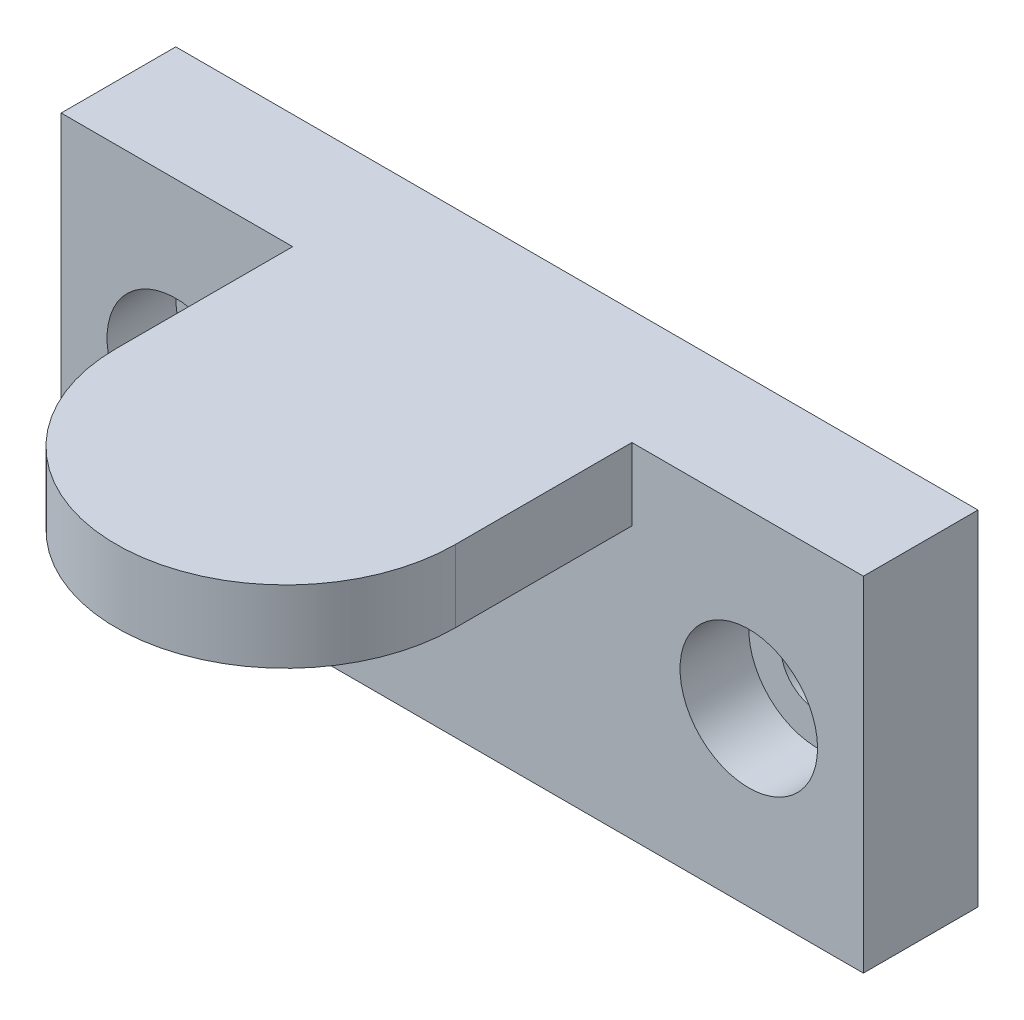
from build123d import *

# Parameters (mm, degrees)
SKETCH1_W           = 70
SKETCH1_H           = 30
BOSS_EXTRUDE1_DEPTH = 10
SKETCH2_R           = 6
CUT_EXTRUDE1_DEPTH  = 6
SKETCH3_R           = 3.2
CUT_EXTRUDE2_DEPTH  = 77.393717019
SKETCH9_R           = 14.8
BOSS_EXTRUDE3_DEPTH = 6.3


with BuildPart() as part:
    # Sketch1 → Boss-Extrude1 (new body)
    with BuildSketch(Plane.XY):
        with Locations((35, -15)):
            Rectangle(SKETCH1_W, SKETCH1_H)
    extrude(amount=BOSS_EXTRUDE1_DEPTH)

    # Sketch2 → Cut-Extrude1 (cut)
    with BuildSketch(Plane.XY.offset(10)):
        with Locations((10, -15)):
            Circle(SKETCH2_R)
        with Locations((60, -15)):
            Circle(SKETCH2_R)
    extrude(amount=-CUT_EXTRUDE1_DEPTH, mode=Mode.SUBTRACT)

    # Sketch3 → Cut-Extrude2 (cut, through all)
    with BuildSketch(Plane.XY.offset(4)):
        with Locations((10, -15)):
            Circle(SKETCH3_R)
        with Locations((60, -15)):
            Circle(SKETCH3_R)
    extrude(amount=-CUT_EXTRUDE2_DEPTH, mode=Mode.SUBTRACT)

    # Sketch9 → Boss-Extrude3 (add)
    with BuildSketch(Plane(origin=(0, 0, 0), x_dir=(1, 0, 0), z_dir=(0, 1, 0))):
        with Locations((35, -25.4)):
            Circle(SKETCH9_R)
        with BuildLine():
            Line((49.8, -25.4), (49.8, -10))
            Line((49.8, -10), (20.2, -10))
            Line((20.2, -10), (20.2, -25.4))
            ThreePointArc((20.2, -25.4), (35, -10.6), (49.8, -25.4))
        make_face()
    extrude(amount=-BOSS_EXTRUDE3_DEPTH)


solid = part.part
